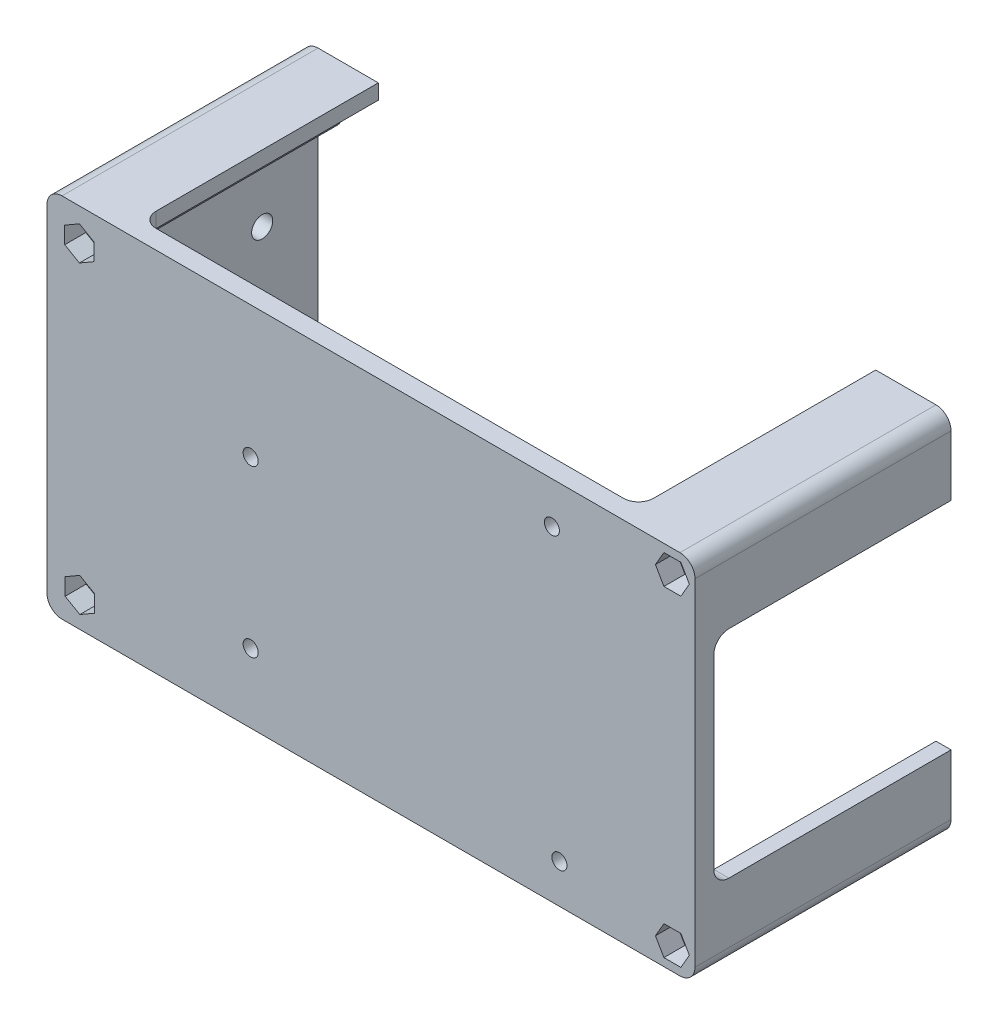
from build123d import *

# Parameters (mm, degrees)
SKETCH1_W           = 109.2835
SKETCH1_H           = 61.8236
SKETCH1_R           = 1.27
SKETCH1_R_2         = 1.5875
BOSS_EXTRUDE1_DEPTH = 3.175
BOSS_EXTRUDE2_START = -40.005
SKETCH3_R           = 1.5875
BOSS_EXTRUDE2_DEPTH = 40.005
SKETCH4_W           = 90.288549843
SKETCH4_H           = 56.7436
CUT_EXTRUDE1_DEPTH  = 1.905
FILLET1_R           = 2.54
SKETCH6_R           = 1.27
BOSS_EXTRUDE3_DEPTH = 5.08
FILLET2_R           = 2.54
SKETCH9_R           = 1.778
CUT_EXTRUDE4_DEPTH  = 3.81
CUT_EXTRUDE5_DEPTH  = 3.556


with BuildPart() as part:
    # Sketch1 → Boss-Extrude1 (new body)
    with BuildSketch(Plane.XY):
        Rectangle(SKETCH1_W, SKETCH1_H)
        with Locations((30.51175, 23.9268)):
            Circle(SKETCH1_R, mode=Mode.SUBTRACT)
        with Locations((-20.28825, 8.6868)):
            Circle(SKETCH1_R, mode=Mode.SUBTRACT)
        with Locations((-20.28825, -19.2532)):
            Circle(SKETCH1_R, mode=Mode.SUBTRACT)
        with Locations((31.78175, -24.3332)):
            Circle(SKETCH1_R, mode=Mode.SUBTRACT)
        with Locations((50.83175, -27.1018)):
            Circle(SKETCH1_R_2, mode=Mode.SUBTRACT)
        with Locations((-49.16805, 25.4381)):
            Circle(SKETCH1_R_2, mode=Mode.SUBTRACT)
        with Locations((-49.10175, -25.8718)):
            Circle(SKETCH1_R_2, mode=Mode.SUBTRACT)
        with Locations(Location((50.83175, 27.1018, 0), (0, 0, 180))):
            Circle(SKETCH1_R_2, mode=Mode.SUBTRACT)
    extrude(amount=BOSS_EXTRUDE1_DEPTH)

    # Sketch3 → Boss-Extrude2 (add)
    # profile 1 of 3: a face of its own
    with BuildSketch(Plane.XY.offset(BOSS_EXTRUDE2_START)):
        with BuildLine():
            Line((-54.64175, 30.9118), (-41.94175, 30.9118))
            Line((-41.94175, 30.9118), (-41.94175, 28.3718))
            Line((-41.94175, 28.3718), (-47.953953912, 28.3718))
            ThreePointArc((-47.953953912, 28.3718), (-46.92298597, 23.19303597), (-52.10175, 24.224003912))
            Line((-52.10175, 24.224003912), (-52.10175, 18.2118))
            Line((-52.10175, 18.2118), (-52.10175, -18.2118))
            Line((-52.10175, -18.2118), (-52.10175, -24.832268856))
            ThreePointArc((-52.10175, -24.832268856), (-47.256776002, -23.28786967), (-47.144551747, -28.3718))
            Line((-47.144551747, -28.3718), (-41.94175, -28.3718))
            Line((-41.94175, -28.3718), (-41.94175, -30.9118))
            Line((-41.94175, -30.9118), (-54.64175, -30.9118))
            Line((-54.64175, -30.9118), (-54.64175, -18.2118))
            Line((-54.64175, -18.2118), (-54.64175, 18.2118))
            Line((-54.64175, 18.2118), (-54.64175, 30.9118))
        make_face()
        with Locations((-49.16805, 25.4381)):
            Circle(SKETCH3_R, mode=Mode.SUBTRACT)
        with Locations((-49.10175, -25.8718)):
            Circle(SKETCH3_R, mode=Mode.SUBTRACT)
    # profile 2 of 3: a face of its own
    with BuildSketch(Plane.XY.offset(BOSS_EXTRUDE2_START)):
        with BuildLine():
            Line((54.64175, 30.9118), (54.64175, 18.2118))
            Line((54.64175, 18.2118), (52.10175, 18.2118))
            Line((52.10175, 18.2118), (52.10175, 22.49507603))
            ThreePointArc((52.10175, 22.49507603), (47.452785237, 23.722835237), (46.22502603, 28.3718))
            Line((46.22502603, 28.3718), (41.94175, 28.3718))
            Line((41.94175, 28.3718), (41.94175, 30.9118))
            Line((41.94175, 30.9118), (54.64175, 30.9118))
        make_face()
        with Locations(Location((50.83175, 27.1018, 0), (0, 0, 180))):
            Circle(SKETCH3_R, mode=Mode.SUBTRACT)
    # profile 3 of 3: a face of its own
    with BuildSketch(Plane.XY.offset(BOSS_EXTRUDE2_START)):
        with BuildLine():
            Line((52.10175, -24.191864434), (52.10175, -18.2118))
            Line((52.10175, -18.2118), (54.64175, -18.2118))
            Line((54.64175, -18.2118), (54.64175, -30.9118))
            Line((54.64175, -30.9118), (41.94175, -30.9118))
            Line((41.94175, -30.9118), (41.94175, -28.3718))
            Line((41.94175, -28.3718), (47.921814434, -28.3718))
            ThreePointArc((47.921814434, -28.3718), (48.58668597, -24.85673597), (52.10175, -24.191864434))
        make_face()
        with Locations((50.83175, -27.1018)):
            Circle(SKETCH3_R, mode=Mode.SUBTRACT)
    extrude(amount=BOSS_EXTRUDE2_DEPTH)

    # Sketch4 → Cut-Extrude1 (cut)
    with BuildSketch(Plane(origin=(0, 0, -40.005), x_dir=(-1, 0, 0), z_dir=(0, 0, -1))):
        with Locations((6.957475078, 0)):
            Rectangle(SKETCH4_W, SKETCH4_H)
    extrude(amount=-CUT_EXTRUDE1_DEPTH, mode=Mode.SUBTRACT)

    # Fillet1
    fillet1_edges = [part.edges().sort_by_distance(p)[0] for p in [
        (52.10175, 22.49507603, -20.0025),
        (46.22502603, 28.3718, -20.0025),
        (-47.144551747, -28.3718, -19.05),
        (-52.10175, -24.832268856, -19.05),
        (-52.10175, 24.224003912, -19.05),
        (-47.953953912, 28.3718, -19.05),
        (-54.64175, 30.9118, -18.415),
        (54.64175, 30.9118, -18.415),
        (54.64175, -30.9118, -18.415),
        (-54.64175, -30.9118, -18.415),
        (47.921814434, -28.3718, -20.0025),
        (52.10175, -24.191864434, -20.0025),
    ]]
    fillet(fillet1_edges, radius=FILLET1_R)

    # Sketch6 → Boss-Extrude3 (add)
    with BuildSketch(Plane.XY):
        with Locations((-40.60825, 15.6718)):
            Circle(SKETCH6_R)
        with Locations((-40.60825, -15.6718)):
            Circle(SKETCH6_R)
    extrude(amount=-BOSS_EXTRUDE3_DEPTH)

    # Fillet2
    fillet2_edges = [part.edges().sort_by_distance(p)[0] for p in [
        (41.94175, 29.6418, 0),
        (53.37175, 18.2118, 0),
        (-41.94175, -29.6418, 0),
        (-41.94175, 29.6418, 0),
        (53.37175, -18.2118, 0),
        (41.94175, -29.6418, 0),
    ]]
    fillet(fillet2_edges, radius=FILLET2_R)

    # Sketch9 → Cut-Extrude4 (cut)
    with BuildSketch(Plane.ZY.offset(54.64175)):
        with Locations((-30.58287, 9.525)):
            Circle(SKETCH9_R)
        with Locations((-30.58287, -9.525)):
            Circle(SKETCH9_R)
        with BuildLine():
            Line((-12.96162, 2.54), (-12.96162, -2.54))
            ThreePointArc((-12.96162, -2.54), (-14.86662, -4.445), (-16.77162, -2.54))
            Line((-16.77162, -2.54), (-16.77162, 2.54))
            ThreePointArc((-16.77162, 2.54), (-14.86662, 4.445), (-12.96162, 2.54))
        make_face()
    extrude(amount=-CUT_EXTRUDE4_DEPTH, mode=Mode.SUBTRACT)

    # Sketch10 → Cut-Extrude5 (cut)
    with BuildSketch(Plane.XY.offset(3.175)):
        Polygon((-49.16805, 28.297715883), (-51.64455, 26.867907942), (-51.64455, 24.008292058), (-49.16805, 22.578484117), (-46.69155, 24.008292058), (-46.69155, 26.867907942), align=None)
        Polygon((-46.62525, -24.441992058), (-49.10175, -23.012184117), (-51.57825, -24.441992058), (-51.57825, -27.301607942), (-49.10175, -28.731415883), (-46.62525, -27.301607942), align=None)
        Polygon((47.972134117, 27.1018), (49.401942058, 24.6253), (52.261557942, 24.6253), (53.691365883, 27.1018), (52.261557942, 29.5783), (49.401942058, 29.5783), align=None)
        Polygon((49.401942058, -24.6253), (47.972134117, -27.1018), (49.401942058, -29.5783), (52.261557942, -29.5783), (53.691365883, -27.1018), (52.261557942, -24.6253), align=None)
    extrude(amount=-CUT_EXTRUDE5_DEPTH, mode=Mode.SUBTRACT)


solid = part.part
